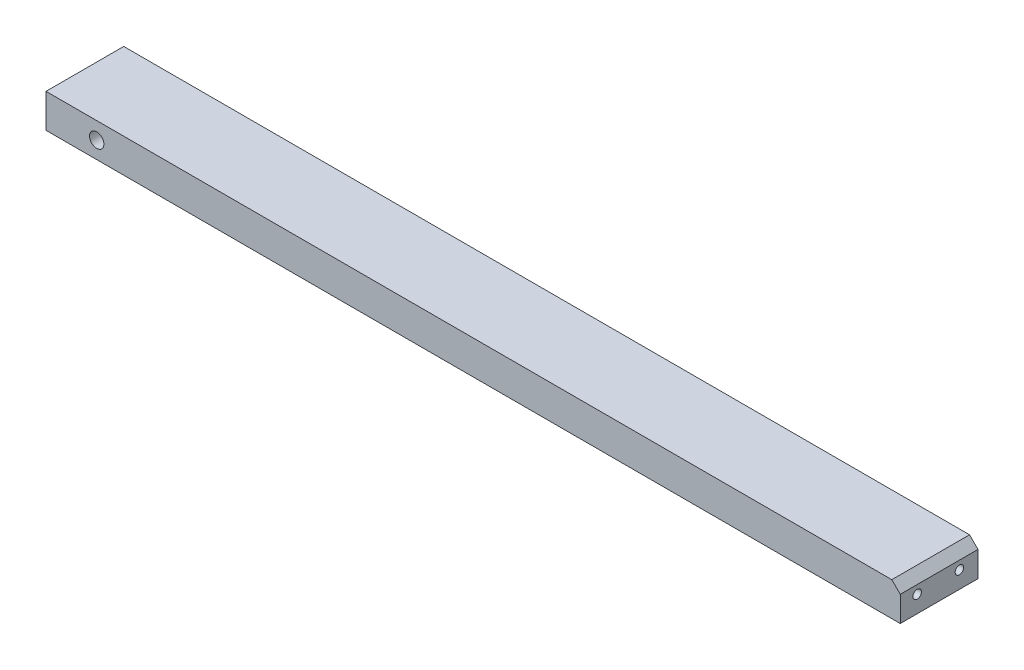
from build123d import *

# Parameters (mm, degrees)
SKIZZE1_W                          = 505.5
SKIZZE1_H                          = 20
LINEAR_AUSTRAGEN1_DEPTH            = 46
M10_GEWINDEBOHRUNG1_D              = 8.5
M10_GEWINDEBOHRUNG1_DEPTH          = 27.5
M10_GEWINDEBOHRUNG1_CSINK_D        = 10.05
M10_GEWINDEBOHRUNG1_CSINK_ANGLE    = 90
M10_GEWINDEBOHRUNG1_TIP            = 2.553657631
F_8_0_8_DURCHMESSER_BOHRUNG1_D     = 8
F_8_0_8_DURCHMESSER_BOHRUNG1_DEPTH = 10
F_8_0_8_DURCHMESSER_BOHRUNG1_TIP   = 2.403442476
M10_GEWINDEBOHRUNG2_D              = 8.5
M10_GEWINDEBOHRUNG2_DEPTH          = 27.5
M10_GEWINDEBOHRUNG2_TIP            = 2.553657631
M6_GEWINDEBOHRUNG1_D               = 5
M6_GEWINDEBOHRUNG1_DEPTH           = 17
M6_GEWINDEBOHRUNG1_TIP             = 1.502151548
FASE1_SIZE                         = 5


with BuildPart() as part:
    # Skizze1 → Linear austragen1 (new body)
    with BuildSketch(Plane.XY):
        Rectangle(SKIZZE1_W, SKIZZE1_H)
    extrude(amount=LINEAR_AUSTRAGEN1_DEPTH)

    # M10 Gewindebohrung1
    with Locations(Plane.ZY.offset(252.75)):
        with Locations((11, 0)):
            CounterSinkHole(M10_GEWINDEBOHRUNG1_D / 2, M10_GEWINDEBOHRUNG1_CSINK_D / 2, depth=M10_GEWINDEBOHRUNG1_DEPTH, counter_sink_angle=M10_GEWINDEBOHRUNG1_CSINK_ANGLE)
            with Locations((0, 0, -(M10_GEWINDEBOHRUNG1_DEPTH + M10_GEWINDEBOHRUNG1_TIP / 2))):  # 118° drill point
                Cone(0, M10_GEWINDEBOHRUNG1_D / 2, M10_GEWINDEBOHRUNG1_TIP, mode=Mode.SUBTRACT)

    # Ø8.0 (8) Durchmesser Bohrung1
    with Locations(Plane.ZY.offset(252.75)):
        with Locations((36, 0)):
            Hole(F_8_0_8_DURCHMESSER_BOHRUNG1_D / 2, depth=F_8_0_8_DURCHMESSER_BOHRUNG1_DEPTH)
            with Locations((0, 0, -(F_8_0_8_DURCHMESSER_BOHRUNG1_DEPTH + F_8_0_8_DURCHMESSER_BOHRUNG1_TIP / 2))):  # 118° drill point
                Cone(0, F_8_0_8_DURCHMESSER_BOHRUNG1_D / 2, F_8_0_8_DURCHMESSER_BOHRUNG1_TIP, mode=Mode.SUBTRACT)

    # M10 Gewindebohrung2
    with Locations(Plane.XY.offset(46)):
        with Locations((-222.75, 0)):
            Hole(M10_GEWINDEBOHRUNG2_D / 2, depth=M10_GEWINDEBOHRUNG2_DEPTH)
            with Locations((0, 0, -(M10_GEWINDEBOHRUNG2_DEPTH + M10_GEWINDEBOHRUNG2_TIP / 2))):  # 118° drill point
                Cone(0, M10_GEWINDEBOHRUNG2_D / 2, M10_GEWINDEBOHRUNG2_TIP, mode=Mode.SUBTRACT)

    # M6 Gewindebohrung1
    with Locations(Plane(origin=(252.75, -240.771899173, -2.604695508), x_dir=(0, 1, 0), z_dir=(1, 0, 0))):
        with Locations((240.771899173, 13.604695508), (240.771899173, 38.604695508)):
            Hole(M6_GEWINDEBOHRUNG1_D / 2, depth=M6_GEWINDEBOHRUNG1_DEPTH)
            with Locations((0, 0, -(M6_GEWINDEBOHRUNG1_DEPTH + M6_GEWINDEBOHRUNG1_TIP / 2))):  # 118° drill point
                Cone(0, M6_GEWINDEBOHRUNG1_D / 2, M6_GEWINDEBOHRUNG1_TIP, mode=Mode.SUBTRACT)

    # Fase1
    fase1_edges = [part.edges().sort_by_distance(p)[0] for p in [
        (252.75, 10, 23),
    ]]
    chamfer(fase1_edges, length=FASE1_SIZE)


solid = part.part
